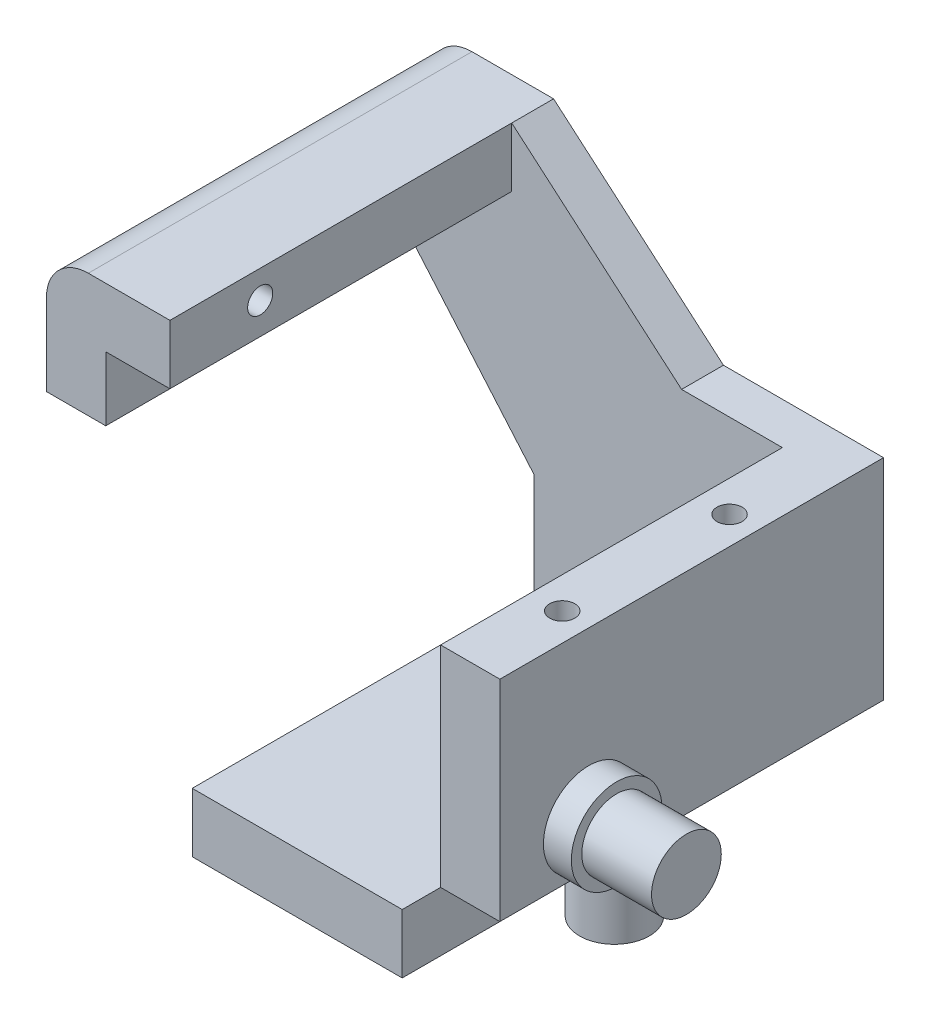
from build123d import *

# Parameters (mm, degrees)
EXTRUDE_1_DEPTH      = 27.5
SKETCH_3_W           = 24
SKETCH_3_H           = 24
CUT_EXTRUDE_3_DEPTH  = 24.5
CUT_EXTRUDE_4_DEPTH  = 24.5
SKETCH_7_R           = 3.25
EXTRUDE_4_DEPTH      = 2
SKETCH_10_R          = 3.25
EXTRUDE_5_DEPTH      = 2
CUT_EXTRUDE_6_DEPTH  = 27.5
CUT_EXTRUDE_7_DEPTH  = 3
SKETCH_16_R          = 0.9
CUT_EXTRUDE_10_DEPTH = 6
SKETCH_20_R          = 2.5
EXTRUDE_6_DEPTH      = 5
SKETCH_25_R          = 2.5
EXTRUDE_7_DEPTH      = 5
SKETCH_27_R          = 0.9
CUT_EXTRUDE_13_DEPTH = 6
SKETCH_26_R          = 0.9
CUT_EXTRUDE_14_DEPTH = 6


with BuildPart() as part:
    # 草图1 → 凸台-拉伸1 (new body)
    with BuildSketch(Plane.XY):
        with BuildLine():
            Line((-16.25, -16.25), (16.25, -16.25))
            Line((16.25, -16.25), (16.25, 16.25))
            Line((16.25, 16.25), (-13.25, 16.25))
            ThreePointArc((-13.25, 16.25), (-15.371320344, 15.371320344), (-16.25, 13.25))
            Line((-16.25, 13.25), (-16.25, -16.25))
        make_face()
    extrude(amount=EXTRUDE_1_DEPTH)

    # 草图3 → 切除-拉伸3 (cut)
    with BuildSketch(Plane.XY.offset(27.5)):
        Rectangle(SKETCH_3_W, SKETCH_3_H)
    extrude(amount=-CUT_EXTRUDE_3_DEPTH, mode=Mode.SUBTRACT)

    # 草图4 → 切除-拉伸4 (cut)
    with BuildSketch(Plane.XY.offset(27.5)):
        Polygon((16.25, 16.25), (-7.4, 16.25), (-7.4, 12), (-0.175, 5.8), (16.25, 5.8), align=None)
    cut_extrude_4 = extrude(amount=-CUT_EXTRUDE_4_DEPTH, mode=Mode.SUBTRACT)

    # 镜向1: 切除-拉伸4 across plane
    add(cut_extrude_4.mirror(Plane(origin=(0, 0, 0), x_dir=(0, 0, 1), z_dir=(0.7071067811865477, 0.7071067811865475, 0))), mode=Mode.SUBTRACT)

    # 草图7 → 凸台-拉伸4 (add)
    with BuildSketch(Plane.XZ.offset(16.25)):
        with Locations(Location((6, 9.04, 0), (0, 0, 90))):
            Circle(SKETCH_7_R)
    extrude(amount=EXTRUDE_4_DEPTH)

    # 草图10 → 凸台-拉伸5 (add)
    with BuildSketch(Plane(origin=(16.25, 0, 0), x_dir=(0, 0, -1), z_dir=(1, 0, 0))):
        with Locations(Location((-21.13, -6, 0), (0, 0, 180))):
            Circle(SKETCH_10_R)
    extrude(amount=EXTRUDE_5_DEPTH)

    # 草图13 → 切除-拉伸6 (cut)
    with BuildSketch(Plane.XY.offset(27.5)):
        with BuildLine():
            Line((16.25, -16.25), (9.25, -16.25))
            Line((9.25, -16.25), (9.25, -12))
            ThreePointArc((9.25, -12), (10.055456352, -10.055456352), (12, -9.25))
            Line((12, -9.25), (16.25, -9.25))
            Line((16.25, -9.25), (16.25, -16.25))
        make_face()
    extrude(amount=-CUT_EXTRUDE_6_DEPTH, mode=Mode.SUBTRACT)

    # 草图14 → 切除-拉伸7 (cut)
    with BuildSketch(Plane.XY.offset(3)):
        Polygon((16.25, 5.8), (4.775755008, 5.8), (-7.4, 16.25), (16.25, 16.25), align=None)
    cut_extrude_7 = extrude(amount=-CUT_EXTRUDE_7_DEPTH, mode=Mode.SUBTRACT)

    # 镜向3: 切除-拉伸7 across plane
    add(cut_extrude_7.mirror(Plane(origin=(0, 0, 0), x_dir=(0, 0, 1), z_dir=(0.7071067811865477, 0.7071067811865475, 0))), mode=Mode.SUBTRACT)

    # 草图16 → 切除-拉伸10 (cut)
    with BuildSketch(Plane(origin=(0, 5.8, 0), x_dir=(1, 0, 0), z_dir=(0, 1, 0))):
        with Locations(Location((14.25, -9.04, 0), (0, 0, 180))):
            Circle(SKETCH_16_R)
        with Locations(Location((14.25, -21.03, 0), (0, 0, 180))):
            Circle(SKETCH_16_R)
    cut_extrude_10 = extrude(amount=-CUT_EXTRUDE_10_DEPTH, mode=Mode.SUBTRACT)

    # 镜向4: 切除-拉伸10 across plane
    add(cut_extrude_10.mirror(Plane(origin=(0, 0, 0), x_dir=(0, 0, 1), z_dir=(0.7071067811865477, 0.7071067811865475, 0))), mode=Mode.SUBTRACT)

    # 草图20 → 凸台-拉伸6 (add)
    with BuildSketch(Plane(origin=(18.25, 0, 0), x_dir=(0, 0, -1), z_dir=(1, 0, 0))):
        with Locations((-21.13, -6)):
            Circle(SKETCH_20_R)
    extrude(amount=EXTRUDE_6_DEPTH)

    # 草图25 → 凸台-拉伸7 (add)
    with BuildSketch(Plane.XZ.offset(18.25)):
        with Locations(Location((6, 9.04, 0), (0, 0, 270))):
            Circle(SKETCH_25_R)
    extrude(amount=EXTRUDE_7_DEPTH)

    # 草图27 → 切除-拉伸13 (cut)
    with BuildSketch(Plane(origin=(-7.4, 0, 0), x_dir=(0, 0, -1), z_dir=(1, 0, 0))):
        with Locations((-21.03, 14.25)):
            Circle(SKETCH_27_R)
    extrude(amount=-CUT_EXTRUDE_13_DEPTH, mode=Mode.SUBTRACT)

    # 草图26 → 切除-拉伸14 (cut)
    with BuildSketch(Plane(origin=(0, 7.4, 0), x_dir=(-1, 0, 0), z_dir=(0, -1, 0))):
        with Locations(Location((14.25, -9.04, 0), (0, 0, 180))):
            Circle(SKETCH_26_R)
    extrude(amount=-CUT_EXTRUDE_14_DEPTH, mode=Mode.SUBTRACT)


solid = part.part
